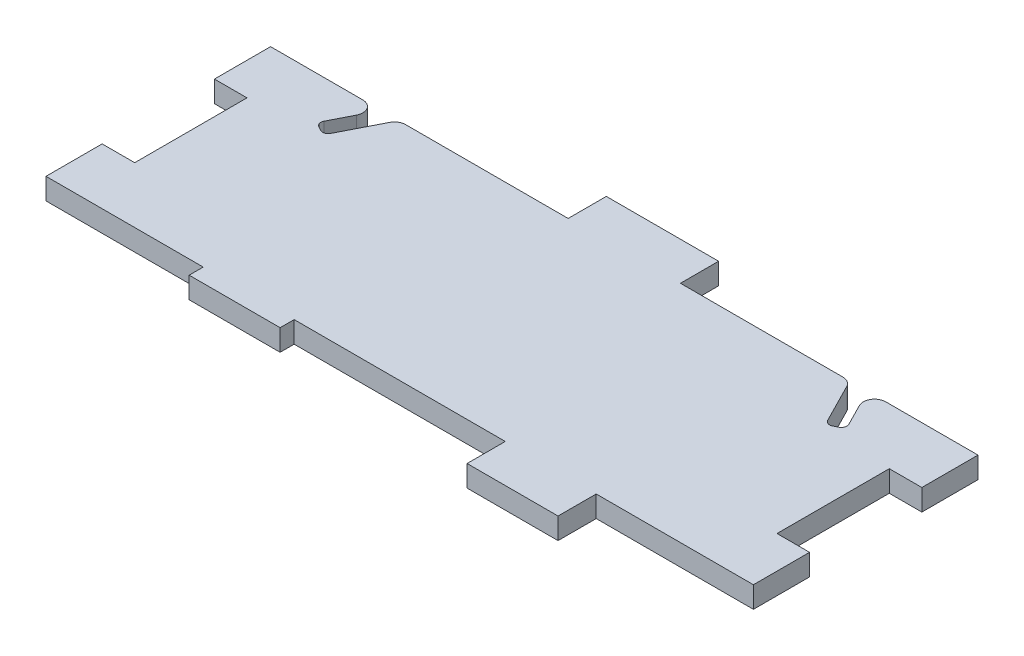
from build123d import *

# Parameters (mm, degrees)
BOSS_EXTRUDE1_DEPTH = 4.826
FILLET1_R           = 1.27
FILLET2_R           = 2.54


with BuildPart() as part:
    # Sketch1 → Boss-Extrude1 (new body)
    with BuildSketch(Plane(origin=(0, 0, 0), x_dir=(1, 0, 0), z_dir=(0, 1, 0))):
        Polygon((-80.01, 25.4), (-55.000893554, 25.4), (-59.944, 15.69860736), (-56.7755808, 14.084217143), (-51.009901453, 25.4), (-12.7, 25.4), (-12.7, 34.036), (12.7, 34.036), (12.7, 25.4), (51.009901453, 25.4), (56.7755808, 14.084217143), (59.944, 15.69860736), (55.000893554, 25.4), (80.01, 25.4), (80.01, 12.7), (72.644, 12.7), (72.644, -12.7), (80.01, -12.7), (80.01, -25.4), (44.45, -25.4), (44.45, -34.036), (23.876, -34.036), (23.876, -25.4), (-23.876, -25.4), (-23.876, -28.575), (-44.45, -28.575), (-44.45, -25.4), (-80.01, -25.4), (-80.01, -12.7), (-72.644, -12.7), (-72.644, 12.7), (-80.01, 12.7), align=None)
    extrude(amount=BOSS_EXTRUDE1_DEPTH)

    # Fillet1
    fillet1_edges = [part.edges().sort_by_distance(p)[0] for p in [
        (-59.944, 2.413, -15.69860736),
        (-56.7755808, 2.413, -14.084217143),
        (56.7755808, 2.413, -14.084217143),
        (59.944, 2.413, -15.69860736),
    ]]
    fillet(fillet1_edges, radius=FILLET1_R)

    # Fillet2
    fillet2_edges = [part.edges().sort_by_distance(p)[0] for p in [
        (-55.000893554, 2.413, -25.4),
        (-51.009901453, 2.413, -25.4),
        (51.009901453, 2.413, -25.4),
        (55.000893554, 2.413, -25.4),
    ]]
    fillet(fillet2_edges, radius=FILLET2_R)


solid = part.part
